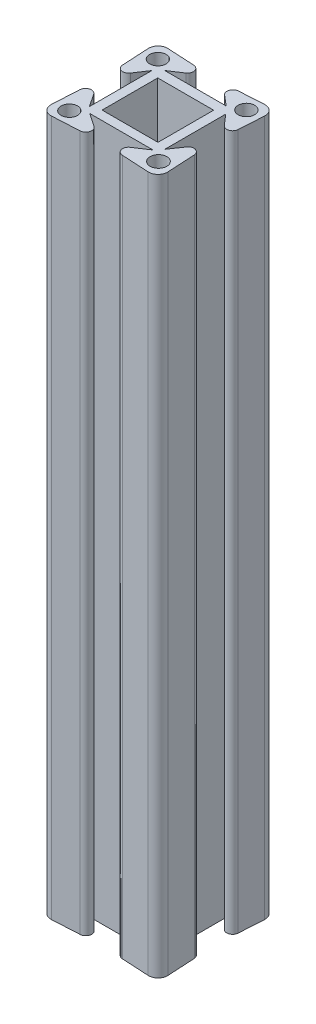
from build123d import *

# Parameters (mm, degrees)
BOSS_EXTRUDE1_DEPTH = 150
FILLET1_R           = 2.032
FILLET2_R           = 1.27
SKETCH5_W           = 12.048677603
SKETCH5_H           = 11.996966541
SKETCH5_R           = 1.809887194
SKETCH5_R_2         = 1.778
SKETCH5_R_3         = 1.784780941
CUT_EXTRUDE3_DEPTH  = 152.558342858
SCALE1_SCALE        = 0.8


with BuildPart() as part:
    # Sketch2 → Boss-Extrude1 (new body)
    with BuildSketch(Plane(origin=(0, 0, 0), x_dir=(1, 0, 0), z_dir=(0, 1, 0))):
        Polygon((-11.631944508, 4.856112595), (-11.631944508, -8.62647921), (-15.607851567, -2.645315933), (-16.258611825, -14.593573265), (-4.310354494, -13.942813006), (-10.340832945, -9.861953178), (3.339587632, -9.861953178), (-2.854456203, -13.936328227), (9.141388175, -14.593573265), (8.484143137, -2.597728887), (4.461618468, -8.47589662), (4.461618468, 4.675168062), (8.490627916, 0), (9.141388175, 10.806426735), (-1.66503856, 10.155666477), (3.011955341, 6.231609797), (-10.257604353, 6.231609797), (-4.292081103, 10.155666477), (-16.258611825, 10.806426735), (-15.607851567, -1.160103987), align=None)
    extrude(amount=BOSS_EXTRUDE1_DEPTH)

    # Fillet1
    fillet1_edges = [part.edges().sort_by_distance(p)[0] for p in [
        (9.141388175, 75, 14.593573265),
        (-16.258611825, 75, 14.593573265),
        (-16.258611825, 75, -10.806426735),
        (9.141388175, 75, -10.806426735),
    ]]
    fillet(fillet1_edges, radius=FILLET1_R)

    # Fillet2
    fillet2_edges = [part.edges().sort_by_distance(p)[0] for p in [
        (8.490627916, 75, 0),
        (8.484143137, 75, 2.597728887),
        (-2.854456203, 75, 13.936328227),
        (-4.310354494, 75, 13.942813006),
        (-15.607851567, 75, 2.645315933),
        (-15.607851567, 75, 1.160103987),
        (-4.292081103, 75, -10.155666477),
        (-1.66503856, 75, -10.155666477),
    ]]
    fillet(fillet2_edges, radius=FILLET2_R)

    # Sketch5 → Cut-Extrude3 (cut, through all)
    with BuildSketch(Plane(origin=(0, 150, 0), x_dir=(1, 0, 0), z_dir=(0, 1, 0))):
        with Locations((-3.593458736, -1.901154881)):
            Rectangle(SKETCH5_W, SKETCH5_H)
        with Locations(Location((6.050654454, -11.415990413, 0), (0, 0, 270))):
            Circle(SKETCH5_R)
        with Locations(Location((-13.030727673, -11.545268069, 0), (0, 0, 270))):
            Circle(SKETCH5_R_2)
        with Locations(Location((-13.108294267, 7.613680652, 0), (0, 0, 270))):
            Circle(SKETCH5_R_2)
        with Locations(Location((5.921376797, 7.665391714, 0), (0, 0, 270))):
            Circle(SKETCH5_R_3)
    extrude(amount=-CUT_EXTRUDE3_DEPTH, mode=Mode.SUBTRACT)


with BuildPart() as part_1:
    # Scale1: scaled about (-3.644090286, 75, 1.930683285)
    add(part.part.scale(SCALE1_SCALE).moved(Location((-0.728818057, 15, 0.386136657))))


solid = part_1.part
